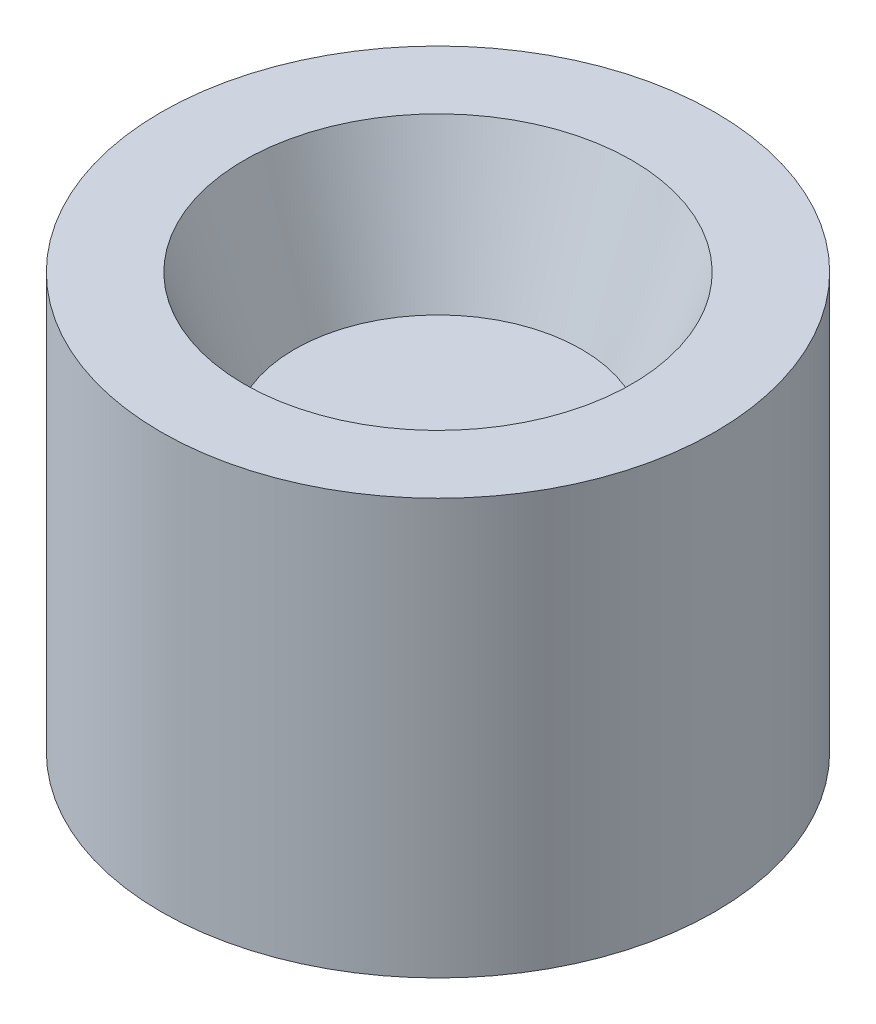
from build123d import *


with BuildPart() as part:
    # Sketch1 → Revolve1 (revolve)
    with BuildSketch(Plane.XY, mode=Mode.PRIVATE) as revolve1_sk:
        Polygon((0, 0), (0, 6.35), (6.578789012, 6.35), (8.89, 12.7), (12.7, 12.7), (12.7, -6.35), (8.89, -6.35), (6.578789012, 0), align=None)
    revolve(revolve1_sk.sketch.rotate(Axis((0, 0, 0), (0, 1, 0)), 90), axis=Axis((0, 0, 0), (0, 1, 0)))


solid = part.part
